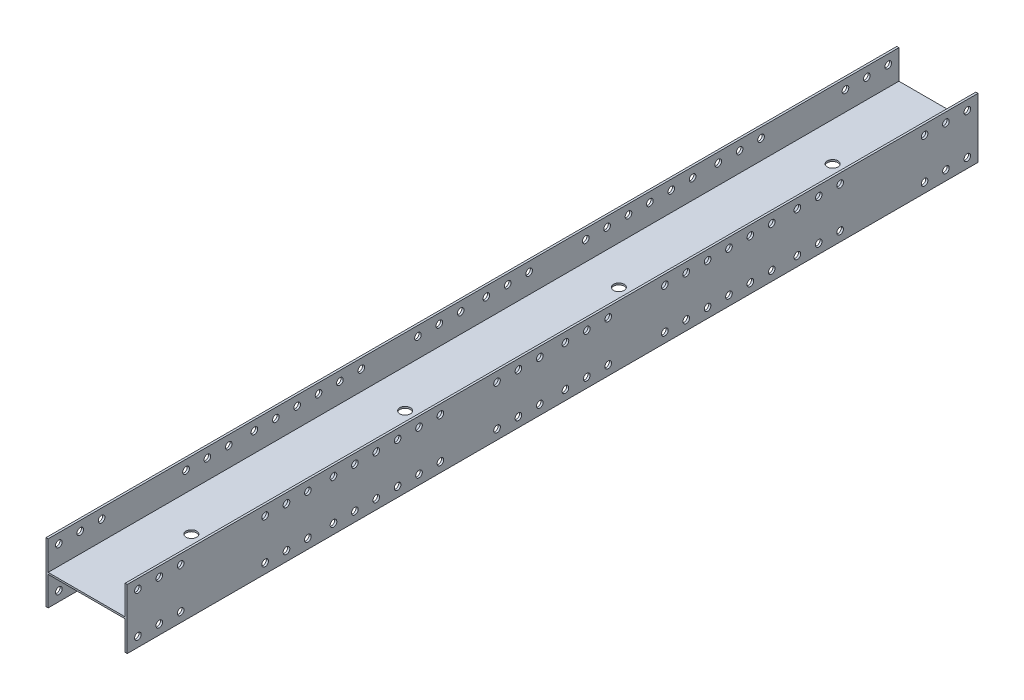
from build123d import *

# Parameters (mm, degrees)
EXTRUDE_1_DEPTH          = 1990
CUT_EXTRUDE_2_DEPTH      = 2004.94610706
CUT_EXTRUDE_2_DEPTH_BACK = 2004.94610706
SKETCH_6_R               = 25
CUT_EXTRUDE_6_DEPTH      = 2004.94610706
CUT_EXTRUDE_6_DEPTH_BACK = 2004.94610706
SKETCH_4_R               = 15.5


with BuildPart() as part:
    # 草图3 → 拉伸1 (new, symmetric)
    with BuildSketch(Plane.XY):
        Polygon((180, -4), (-180, -4), (-180, -140), (-190, -140), (-190, 140), (-180, 140), (-180, 4), (180, 4), (180, 140), (190, 140), (190, -140), (180, -140), align=None)
    extrude(amount=EXTRUDE_1_DEPTH, both=True)

    # 草图6 → 拉伸2 (cut, two sides: drawn at the far end of the back side and taken through both)
    with BuildSketch(Plane(origin=(0, 0, 0), x_dir=(1, 0, 0), z_dir=(0, 1, 0)).offset(-CUT_EXTRUDE_2_DEPTH_BACK)):
        with Locations(Location((0, 500, 0), (0, 0, 270))):
            Circle(SKETCH_6_R)
        with Locations(Location((0, 1500, 0), (0, 0, 270))):
            Circle(SKETCH_6_R)
        with Locations(Location((0, -1500, 0), (0, 0, 270))):
            Circle(SKETCH_6_R)
        with Locations(Location((0, -500, 0), (0, 0, 270))):
            Circle(SKETCH_6_R)
    extrude(amount=CUT_EXTRUDE_2_DEPTH + CUT_EXTRUDE_2_DEPTH_BACK, mode=Mode.SUBTRACT)

    # 草图4 → 拉伸6 (cut, two sides: drawn at the far end of the back side and taken through both)
    with BuildSketch(Plane(origin=(0, 0, 0), x_dir=(0, 0, -1), z_dir=(1, 0, 0)).offset(-CUT_EXTRUDE_6_DEPTH_BACK)):
        with Locations((-1940, 95)):
            Circle(SKETCH_4_R)
        with Locations((-1840, 95)):
            Circle(SKETCH_4_R)
        with Locations((-1740, 95)):
            Circle(SKETCH_4_R)
        with Locations((-1345, 95)):
            Circle(SKETCH_4_R)
        with Locations((-1245, 95)):
            Circle(SKETCH_4_R)
        with Locations((-1145, 95)):
            Circle(SKETCH_4_R)
        with Locations((-260, 95)):
            Circle(SKETCH_4_R)
        with Locations((-160, 95)):
            Circle(SKETCH_4_R)
        with Locations((-60, 95)):
            Circle(SKETCH_4_R)
        with Locations((-525, -95)):
            Circle(SKETCH_4_R)
        with Locations((-625, -95)):
            Circle(SKETCH_4_R)
        with Locations((-725, -95)):
            Circle(SKETCH_4_R)
        with Locations((-825, -95)):
            Circle(SKETCH_4_R)
        with Locations((-925, -95)):
            Circle(SKETCH_4_R)
        with Locations((-1025, -95)):
            Circle(SKETCH_4_R)
        with Locations((-60, -95)):
            Circle(SKETCH_4_R)
        with Locations((-160, -95)):
            Circle(SKETCH_4_R)
        with Locations((-260, -95)):
            Circle(SKETCH_4_R)
        with Locations((-1145, -95)):
            Circle(SKETCH_4_R)
        with Locations((-1245, -95)):
            Circle(SKETCH_4_R)
        with Locations((-1345, -95)):
            Circle(SKETCH_4_R)
        with Locations((-1740, -95)):
            Circle(SKETCH_4_R)
        with Locations((-1840, -95)):
            Circle(SKETCH_4_R)
        with Locations((-1940, -95)):
            Circle(SKETCH_4_R)
        with Locations((-1025, 95)):
            Circle(SKETCH_4_R)
        with Locations((-925, 95)):
            Circle(SKETCH_4_R)
        with Locations((-825, 95)):
            Circle(SKETCH_4_R)
        with Locations((-725, 95)):
            Circle(SKETCH_4_R)
        with Locations((-625, 95)):
            Circle(SKETCH_4_R)
        with Locations((-525, 95)):
            Circle(SKETCH_4_R)
        with Locations((525, 95)):
            Circle(SKETCH_4_R)
        with Locations((625, 95)):
            Circle(SKETCH_4_R)
        with Locations((725, 95)):
            Circle(SKETCH_4_R)
        with Locations((825, 95)):
            Circle(SKETCH_4_R)
        with Locations((925, 95)):
            Circle(SKETCH_4_R)
        with Locations((1025, 95)):
            Circle(SKETCH_4_R)
        with Locations((1940, -95)):
            Circle(SKETCH_4_R)
        with Locations((1840, -95)):
            Circle(SKETCH_4_R)
        with Locations((1740, -95)):
            Circle(SKETCH_4_R)
        with Locations((1345, -95)):
            Circle(SKETCH_4_R)
        with Locations((1245, -95)):
            Circle(SKETCH_4_R)
        with Locations((1145, -95)):
            Circle(SKETCH_4_R)
        with Locations((260, -95)):
            Circle(SKETCH_4_R)
        with Locations((160, -95)):
            Circle(SKETCH_4_R)
        with Locations((60, -95)):
            Circle(SKETCH_4_R)
        with Locations((1025, -95)):
            Circle(SKETCH_4_R)
        with Locations((925, -95)):
            Circle(SKETCH_4_R)
        with Locations((825, -95)):
            Circle(SKETCH_4_R)
        with Locations((725, -95)):
            Circle(SKETCH_4_R)
        with Locations((625, -95)):
            Circle(SKETCH_4_R)
        with Locations((525, -95)):
            Circle(SKETCH_4_R)
        with Locations((60, 95)):
            Circle(SKETCH_4_R)
        with Locations((160, 95)):
            Circle(SKETCH_4_R)
        with Locations((260, 95)):
            Circle(SKETCH_4_R)
        with Locations((1145, 95)):
            Circle(SKETCH_4_R)
        with Locations((1245, 95)):
            Circle(SKETCH_4_R)
        with Locations((1345, 95)):
            Circle(SKETCH_4_R)
        with Locations((1740, 95)):
            Circle(SKETCH_4_R)
        with Locations((1840, 95)):
            Circle(SKETCH_4_R)
        with Locations((1940, 95)):
            Circle(SKETCH_4_R)
    extrude(amount=CUT_EXTRUDE_6_DEPTH + CUT_EXTRUDE_6_DEPTH_BACK, mode=Mode.SUBTRACT)


solid = part.part
